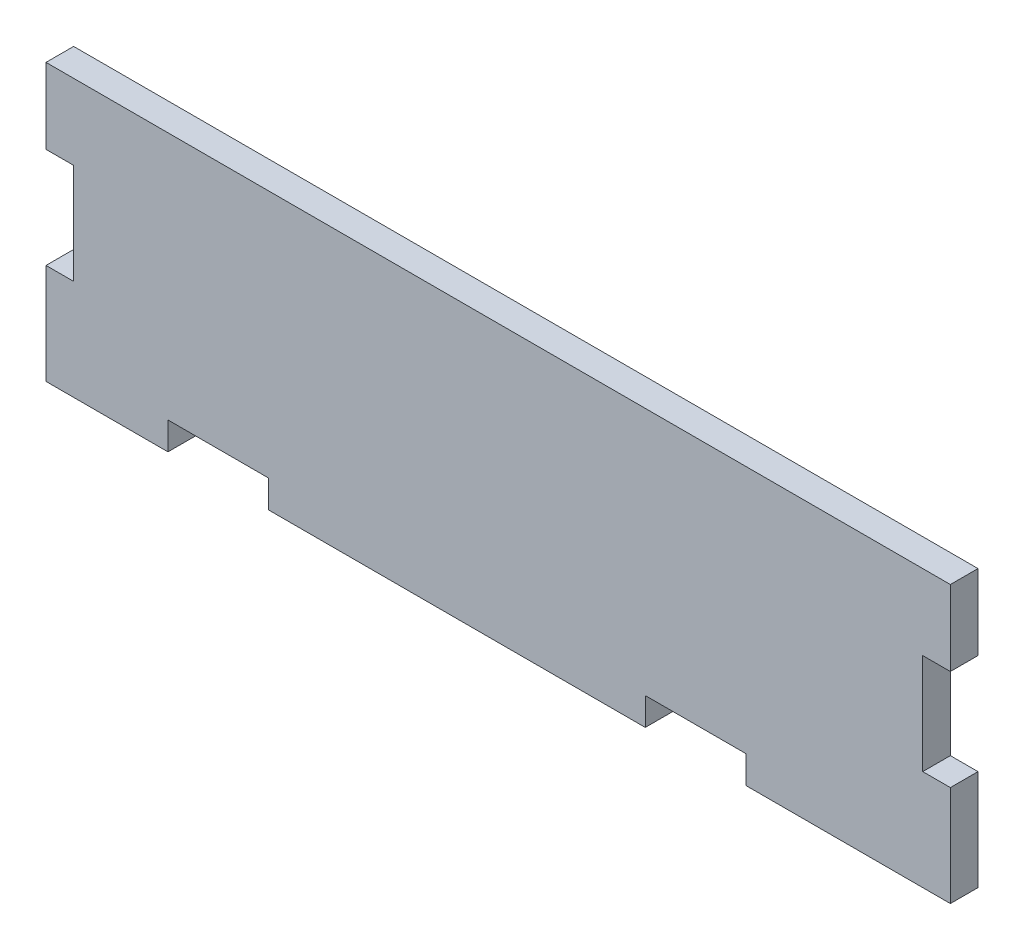
from build123d import *

# Parameters (mm, degrees)
BOSS_EXTRUDE1_DEPTH = 5.5


with BuildPart() as part:
    # Sketch1 → Boss-Extrude1 (new body)
    with BuildSketch(Plane.XY):
        Polygon((8.224518543, 0), (32.5, 0), (32.5, 5.5), (52.5, 5.5), (52.5, 0), (80, 0), (100, 0), (127.5, 0), (127.5, 5.5), (147.5, 5.5), (147.5, 0), (188.224518543, 0), (188.224518543, 20), (182.724518543, 20), (182.724518543, 40), (188.224518543, 40), (188.224518543, 55), (8.224518543, 55), (8.224518543, 40), (13.724518543, 40), (13.724518543, 20), (8.224518543, 20), align=None)
    extrude(amount=BOSS_EXTRUDE1_DEPTH)


solid = part.part
